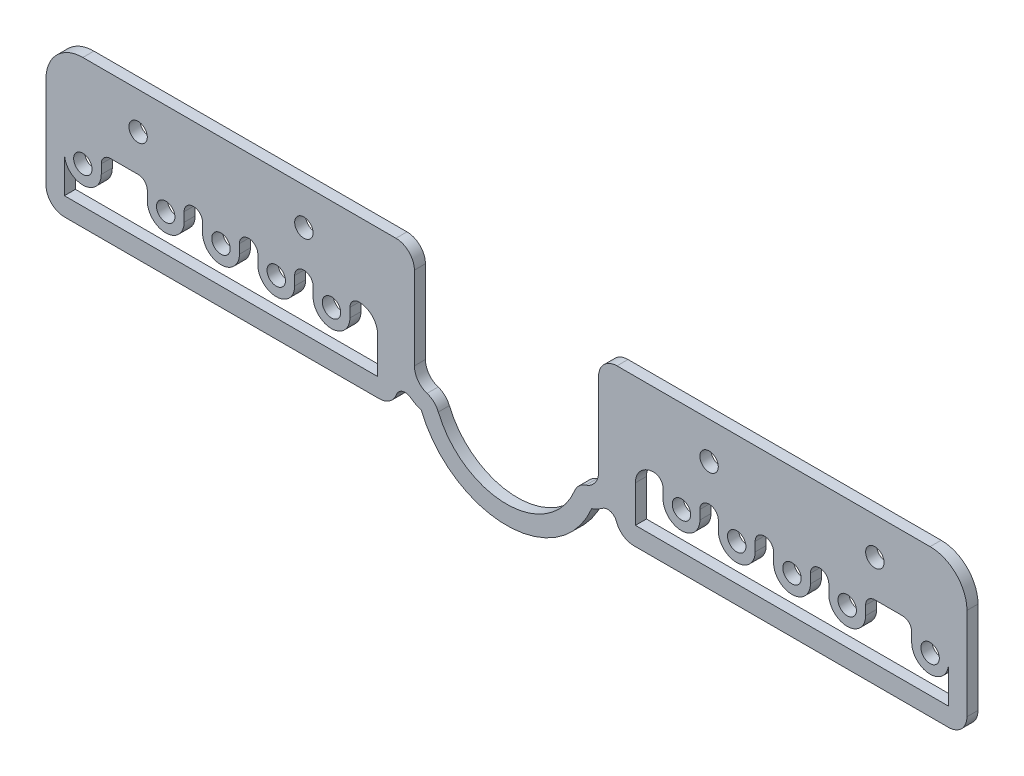
from build123d import *

# Parameters (mm, degrees)
BOSS_EXTRUDE1_DEPTH = 6
SKETCH3_R           = 5
CUT_EXTRUDE1_DEPTH  = 262.076617107
SKETCH4_R           = 5
CUT_EXTRUDE2_DEPTH  = 262.076617107
CUT_EXTRUDE5_DEPTH  = 262.076617107
FILLET5_R           = 5
FILLET6_R           = 5
SKETCH9_W           = 180
SKETCH9_H           = 10
BOSS_EXTRUDE2_DEPTH = 6
CUT_EXTRUDE6_DEPTH  = 262.076617107
FILLET7_R           = 10
SKETCH11_R          = 5
BOSS_EXTRUDE3_DEPTH = 6


with BuildPart() as part:
    # Sketch1 → Boss-Extrude1 (new body)
    with BuildSketch(Plane.XY):
        with BuildLine():
            Line((-250, -55), (-250, 3.178280867))
            Line((-250, 3.178280867), (-250, 55))
            ThreePointArc((-250, 55), (-244.142135624, 69.142135624), (-230, 75))
            Line((-230, 75), (-220, 75))
            Line((-220, 75), (-164.330865428, 75))
            Line((-164.330865428, 75), (-60, 75))
            ThreePointArc((-60, 75), (-52.928932188, 72.071067812), (-50, 65))
            Line((-50, 65), (-50, 20))
            ThreePointArc((-50, 20), (-48.100925873, 14.1369803), (-43.125, 10.500822404))
            ThreePointArc((-43.125, 10.500822404), (-39.437786703, 8.32242004), (-37, 4.801315846))
            ThreePointArc((-37, 4.801315846), (-22.271648276, -13.226099426), (0, -20))
            Line((0, -20), (0, -40))
            Line((0, -40), (0, -65))
            Line((0, -65), (0, -75))
            Line((0, -75), (-230, -75))
            ThreePointArc((-230, -75), (-244.142135624, -69.142135624), (-250, -55))
        make_face()
    boss_extrude1 = extrude(amount=BOSS_EXTRUDE1_DEPTH)

    # Mirror1: Boss-Extrude1 across plane
    add(boss_extrude1.mirror(Plane(origin=(0, -20, 6), x_dir=(0, 0, 1), z_dir=(-1, 0, 0))))

    # Sketch3 → Cut-Extrude1 (cut, through all)
    with BuildSketch(Plane.XY.offset(6)):
        with Locations((110, 55)):
            Circle(SKETCH3_R)
        with Locations((200, 55)):
            Circle(SKETCH3_R)
        with Locations((-110, 55)):
            Circle(SKETCH3_R)
        with Locations((-200, 55)):
            Circle(SKETCH3_R)
    extrude(amount=-CUT_EXTRUDE1_DEPTH, mode=Mode.SUBTRACT)

    # Sketch4 → Cut-Extrude2 (cut, through all)
    with BuildSketch(Plane.XY.offset(6)):
        with BuildLine():
            Line((-70, -55), (-70, 25))
            ThreePointArc((-70, 25), (-72.928932188, 32.071067812), (-80, 35))
            Line((-80, 35), (-110, 35))
            ThreePointArc((-110, 35), (-113.535533906, 33.535533906), (-115, 30))
            Line((-115, 30), (-115, 25))
            ThreePointArc((-115, 25), (-115.614239502, 21.549275456), (-117.381499976, 18.522465177))
            ThreePointArc((-117.381499976, 18.522465177), (-117.5115076, 18.372596167), (-117.644462896, 18.225335882))
            ThreePointArc((-117.644462896, 18.225335882), (-122.017250069, 15.45520022), (-127.189262676, 15.242585951))
            ThreePointArc((-127.189262676, 15.242585951), (-127.232362089, 15.252356208), (-127.275417902, 15.262316838))
            ThreePointArc((-127.275417902, 15.262316838), (-131.839411289, 17.704627959), (-134.570789944, 22.101728126))
            ThreePointArc((-134.570789944, 22.101728126), (-134.892115533, 23.535059632), (-135, 25))
            Line((-135, 25), (-135, 30))
            ThreePointArc((-135, 30), (-136.464466094, 33.535533906), (-140, 35))
            Line((-140, 35), (-215, 35))
            ThreePointArc((-215, 35), (-218.535533906, 33.535533906), (-220, 30))
            Line((-220, 30), (-220, 25))
            ThreePointArc((-220, 25), (-220.586588267, 21.625436392), (-222.277535909, 18.646768667))
            ThreePointArc((-222.277535909, 18.646768667), (-226.488765584, 15.636708224), (-231.640827685, 15.135534251))
            ThreePointArc((-231.640827685, 15.135534251), (-237.629163678, 18.535028107), (-240, 25))
            Line((-240, 25), (-240, -55))
            ThreePointArc((-240, -55), (-237.071067812, -62.071067812), (-230, -65))
            Line((-230, -65), (-210, -65))
            Line((-210, -65), (-190, -65))
            Line((-190, -65), (-110, -65))
            Line((-110, -65), (-90, -65))
            Line((-90, -65), (-80, -65))
            ThreePointArc((-80, -65), (-72.928932188, -62.071067812), (-70, -55))
        make_face()
        with Locations((-230, 25)):
            Circle(SKETCH4_R)
        with Locations((-125, 25)):
            Circle(SKETCH4_R)
    cut_extrude2 = extrude(amount=-CUT_EXTRUDE2_DEPTH, mode=Mode.SUBTRACT)

    # Sketch8 → Cut-Extrude5 (cut, through all)
    with BuildSketch(Plane.XY.offset(6)):
        with BuildLine():
            Line((-60, 0), (-60, -65))
            Line((-60, -65), (60, -65))
            Line((60, -65), (60, 0))
            ThreePointArc((60, 0), (57.236067977, 4.472135955), (52, 4))
            ThreePointArc((52, 4), (49.247332505, 2.266223145), (46.25, 1.001644808))
            ThreePointArc((46.25, 1.001644808), (0, -30), (-46.25, 1.001644808))
            ThreePointArc((-46.25, 1.001644808), (-49.247332505, 2.266223145), (-52, 4))
            ThreePointArc((-52, 4), (-57.236067977, 4.472135955), (-60, 0))
        make_face()
    extrude(amount=-CUT_EXTRUDE5_DEPTH, mode=Mode.SUBTRACT)

    # Fillet5
    fillet5_edges = [part.edges().sort_by_distance(p)[0] for p in [
        (-60, -65, 3),
    ]]
    fillet(fillet5_edges, radius=FILLET5_R)

    # Fillet6
    fillet6_edges = [part.edges().sort_by_distance(p)[0] for p in [
        (60, -65, 3),
    ]]
    fillet(fillet6_edges, radius=FILLET6_R)

    # Mirror2: Cut-Extrude2 across plane
    add(cut_extrude2.mirror(Plane(origin=(0, 0, 0), x_dir=(0, 0, 1), z_dir=(1, 0, 0))), mode=Mode.SUBTRACT)

    # Sketch9 → Boss-Extrude2 (add)
    with BuildSketch(Plane.XY.offset(6)):
        with Locations((-160, 0)):
            Rectangle(SKETCH9_W, SKETCH9_H)
        with Locations((160, 0)):
            Rectangle(SKETCH9_W, SKETCH9_H)
    extrude(amount=-BOSS_EXTRUDE2_DEPTH)

    # Sketch10 → Cut-Extrude6 (cut, through all)
    with BuildSketch(Plane.XY.offset(6)):
        with BuildLine():
            Line((-240, -5), (-250, -5))
            Line((-250, -5), (-250, -80.075651127))
            Line((-250, -80.075651127), (258.523461634, -80.075651127))
            Line((258.523461634, -80.075651127), (258.523461634, -5))
            Line((258.523461634, -5), (43.301270189, -5))
            ThreePointArc((43.301270189, -5), (0, -30), (-43.301270189, -5))
            Line((-43.301270189, -5), (-240, -5))
        make_face()
    extrude(amount=-CUT_EXTRUDE6_DEPTH, mode=Mode.SUBTRACT)

    # Fillet7
    fillet7_edges = [part.edges().sort_by_distance(p)[0] for p in [
        (-60, -5, 3),
        (250, -5, 3),
        (60, -5, 3),
        (-250, -5, 3),
    ]]
    fillet(fillet7_edges, radius=FILLET7_R)

    # Sketch11 → Boss-Extrude3 (add)
    with BuildSketch(Plane.XY.offset(6)):
        with BuildLine():
            ThreePointArc((-195, 30), (-196.464466094, 33.535533906), (-200, 35))
            Line((-200, 35), (-200, 37.801896892))
            Line((-200, 37.801896892), (-80, 37.801896892))
            Line((-80, 37.801896892), (-80, 35))
            ThreePointArc((-80, 35), (-83.535533906, 33.535533906), (-85, 30))
            Line((-85, 30), (-85, 25))
            ThreePointArc((-85, 25), (-95, 15), (-105, 25))
            Line((-105, 25), (-105, 30))
            ThreePointArc((-105, 30), (-106.464466094, 33.535533906), (-110, 35))
            ThreePointArc((-110, 35), (-113.535533906, 33.535533906), (-115, 30))
            Line((-115, 30), (-115, 25))
            ThreePointArc((-115, 25), (-125, 15), (-135, 25))
            Line((-135, 25), (-135, 30))
            ThreePointArc((-135, 30), (-136.464466094, 33.535533906), (-140, 35))
            ThreePointArc((-140, 35), (-143.535533906, 33.535533906), (-145, 30))
            Line((-145, 30), (-145, 25))
            ThreePointArc((-145, 25), (-155, 15), (-165, 25))
            Line((-165, 25), (-165, 30))
            ThreePointArc((-165, 30), (-166.464466094, 33.535533906), (-170, 35))
            ThreePointArc((-170, 35), (-173.535533906, 33.535533906), (-175, 30))
            Line((-175, 30), (-175, 25))
            ThreePointArc((-175, 25), (-185, 15), (-195, 25))
            Line((-195, 25), (-195, 30))
        make_face()
        with Locations((-185, 25)):
            Circle(SKETCH11_R, mode=Mode.SUBTRACT)
        with Locations((-155, 25)):
            Circle(SKETCH11_R, mode=Mode.SUBTRACT)
        with Locations((-95, 25)):
            Circle(SKETCH11_R, mode=Mode.SUBTRACT)
        with Locations((-125, 25)):
            Circle(SKETCH11_R, mode=Mode.SUBTRACT)
    boss_extrude3 = extrude(amount=-BOSS_EXTRUDE3_DEPTH)

    # Mirror3: Boss-Extrude3 across plane
    add(boss_extrude3.mirror(Plane(origin=(0, 0, 0), x_dir=(0, 0, 1), z_dir=(1, 0, 0))))


solid = part.part
